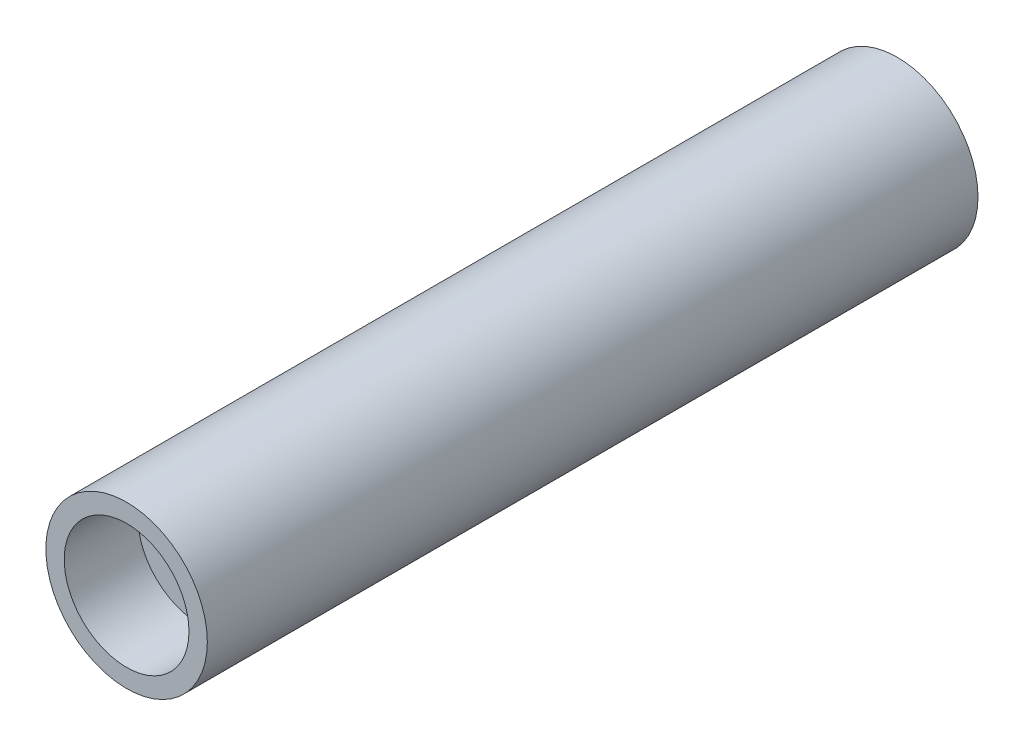
from build123d import *

# Parameters (mm, degrees)
SKETCH2_R           = 22
SKETCH2_R_2         = 17
BOSS_EXTRUDE1_DEPTH = 210
BOSS_EXTRUDE2_START = -20
SKETCH3_R           = 16.95
SKETCH3_R_2         = 5
BOSS_EXTRUDE2_DEPTH = 150


with BuildPart() as part:
    # Sketch2 → Boss-Extrude1 (new body)
    with BuildSketch(Plane.XY):
        Circle(SKETCH2_R)
        Circle(SKETCH2_R_2, mode=Mode.SUBTRACT)
    extrude(amount=BOSS_EXTRUDE1_DEPTH)


with BuildPart() as body_2:
    # Sketch3 → Boss-Extrude2 (new body)
    with BuildSketch(Plane.XY.offset(210).offset(BOSS_EXTRUDE2_START)):
        Circle(SKETCH3_R)
        Circle(SKETCH3_R_2, mode=Mode.SUBTRACT)
    extrude(amount=-BOSS_EXTRUDE2_DEPTH)


solid = Compound([part.part, body_2.part])
